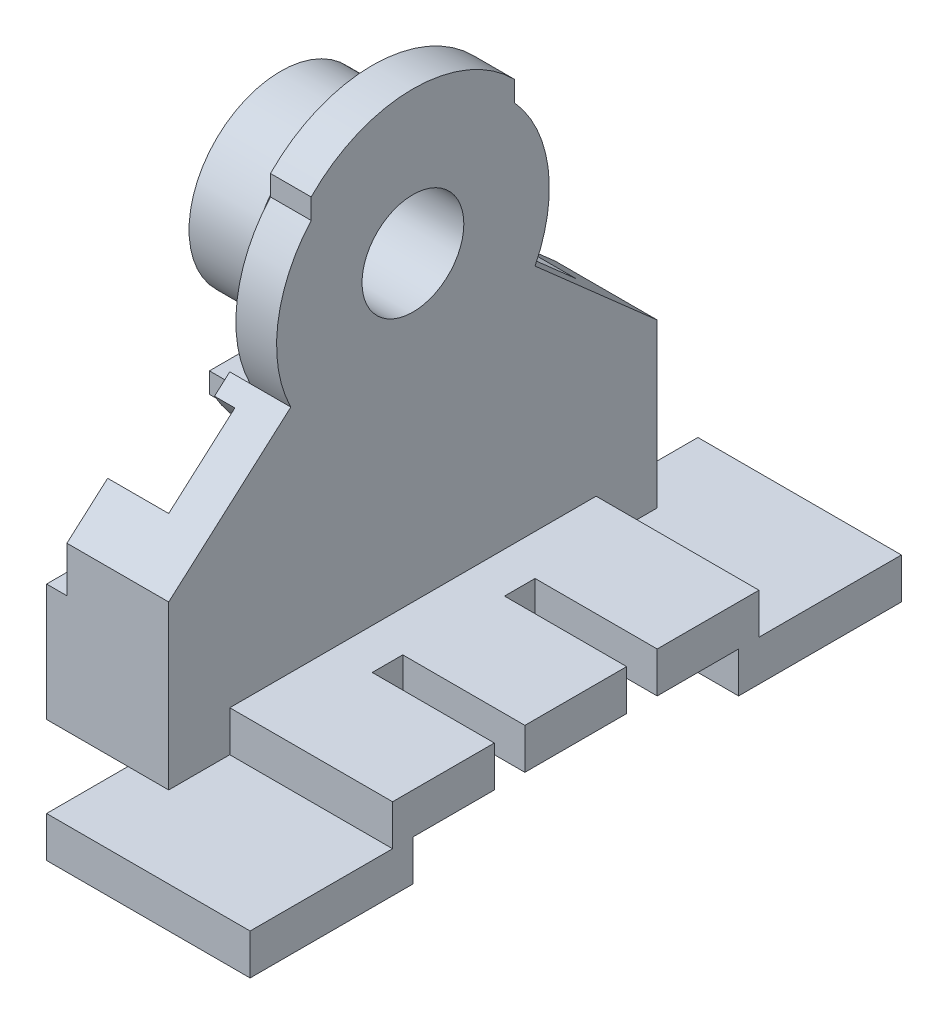
from build123d import *

# Parameters (mm, degrees)
SCHIZZO2_W                     = 10
SCHIZZO2_H                     = 8
ESTRUSIONE_ESTRUSIONE1_DEPTH   = 2
ESTRUSIONE_ESTRUSIONE1_2_DEPTH = 2
ESTRUSIONE_ESTRUSIONE2_DEPTH   = 2
ESTRUSIONE_ESTRUSIONE3_DEPTH   = 26
TAGLIO_ESTRUSIONE1_DEPTH       = 34.763886032
TAGLIO_ESTRUSIONE1_DEPTH_BACK  = 34.763886032
TAGLIO_ESTRUSIONE2_DEPTH       = 32.990517073
TAGLIO_ESTRUSIONE2_DEPTH_BACK  = 32.990517073
SCHIZZO8_R                     = 2.5
ESTRUSIONE_ESTRUSIONE4_DEPTH   = 1
SCHIZZO11_W                    = 8
SCHIZZO11_H                    = 1
ESTRUSIONE_ESTRUSIONE5_DEPTH   = 4
ESTRUSIONE_ESTRUSIONE6_START   = -4.5
SCHIZZO12_R                    = 4.5
SCHIZZO12_R_2                  = 2.5
ESTRUSIONE_ESTRUSIONE6_DEPTH   = 4.5
ESTRUSIONE_ESTRUSIONE7_START   = -1
SCHIZZO13_R                    = 5
SCHIZZO13_R_2                  = 4.5
ESTRUSIONE_ESTRUSIONE7_DEPTH   = 1
TAGLIO_ESTRUSIONE3_START       = 12
SCHIZZO14_W                    = 1
SCHIZZO14_H                    = 4
TAGLIO_ESTRUSIONE3_DEPTH       = 44.990517073
ESTRUSIONE_ESTRUSIONE8_DEPTH   = 1


with BuildPart() as part:
    # Schizzo2 → Estrusione-Estrusione1 (new body)
    with BuildSketch(Plane(origin=(0, 0, 0), x_dir=(1, 0, 0), z_dir=(0, 1, 0))):
        with Locations((5, 12)):
            Rectangle(SCHIZZO2_W, SCHIZZO2_H)
    extrude(amount=ESTRUSIONE_ESTRUSIONE1_DEPTH)



with BuildPart() as body_2:
    # Schizzo2 → Estrusione-Estrusione1 2 (new body)
    with BuildSketch(Plane(origin=(0, 0, 0), x_dir=(1, 0, 0), z_dir=(0, 1, 0))):
        with Locations((5, -12)):
            Rectangle(SCHIZZO2_W, SCHIZZO2_H)
    extrude(amount=ESTRUSIONE_ESTRUSIONE1_2_DEPTH)


with BuildPart() as part_1:
    add(part.part)

    add(body_2.part)  # Estrusione-Estrusione2 merges body 2
    # Schizzo3 → Estrusione-Estrusione2 (add)
    with BuildSketch(Plane(origin=(0, 2, 0), x_dir=(1, 0, 0), z_dir=(0, 1, 0))):
        Polygon((0, -9), (10, -9), (10, -4), (4, -4), (4, -2.5), (10, -2.5), (10, 2.5), (4, 2.5), (4, 4), (10, 4), (10, 9), (0, 9), align=None)
    extrude(amount=ESTRUSIONE_ESTRUSIONE2_DEPTH)

    # Schizzo5 → Estrusione-Estrusione3 (add)
    with BuildSketch(Plane(origin=(0, 2, 0), x_dir=(1, 0, 0), z_dir=(0, 1, 0))):
        Polygon((-4, 12), (2, 12), (2, -12), (-4, -12), (-4, -10), (0, -10), (0, 10), (-4, 10), align=None)
    extrude(amount=ESTRUSIONE_ESTRUSIONE3_DEPTH)

    # Schizzo6 → Taglio-Estrusione1 (cut, two sides: drawn at the far end of the back side and taken through both)
    with BuildSketch(Plane(origin=(0, 0, 0), x_dir=(0, 0, -1), z_dir=(1, 0, 0)).offset(-TAGLIO_ESTRUSIONE1_DEPTH_BACK)):
        with BuildLine():
            Line((-12, 10), (-12, 28))
            Line((-12, 28), (12, 28))
            Line((12, 28), (12, 10))
            Line((12, 10), (6, 15.291502622))
            ThreePointArc((6, 15.291502622), (6.640310502, 19.165456154), (5, 22.732933549))
            Line((5, 22.732933549), (5, 23.732933549))
            ThreePointArc((5, 23.732933549), (0, 25.833954064), (-5, 23.732933549))
            Line((-5, 23.732933549), (-5, 22.732933549))
            ThreePointArc((-5, 22.732933549), (-6.640310502, 19.165456154), (-6, 15.291502622))
            Line((-6, 15.291502622), (-12, 10))
        make_face()
    extrude(amount=TAGLIO_ESTRUSIONE1_DEPTH + TAGLIO_ESTRUSIONE1_DEPTH_BACK, mode=Mode.SUBTRACT)

    # Schizzo8 → Taglio-Estrusione2 (cut, two sides: drawn at the far end of the back side and taken through both)
    with BuildSketch(Plane(origin=(0, 0, 0), x_dir=(0, 0, -1), z_dir=(1, 0, 0)).offset(-TAGLIO_ESTRUSIONE2_DEPTH_BACK)):
        with Locations((0, 18.833954064)):
            Circle(SCHIZZO8_R)
    extrude(amount=TAGLIO_ESTRUSIONE2_DEPTH + TAGLIO_ESTRUSIONE2_DEPTH_BACK, mode=Mode.SUBTRACT)

    # Schizzo9 → Estrusione-Estrusione4 (add, symmetric)
    with BuildSketch(Plane.XY):
        Polygon((8, 2), (6.5, 2), (6.5, 0.5), align=None)
    extrude(amount=ESTRUSIONE_ESTRUSIONE4_DEPTH, both=True)

    # Schizzo11 → Estrusione-Estrusione5 (add)
    with BuildSketch(Plane(origin=(0, 0, 0), x_dir=(0, 0, -1), z_dir=(1, 0, 0))):
        with Locations((0, 12.333954064)):
            Rectangle(SCHIZZO11_W, SCHIZZO11_H)
    extrude(amount=-ESTRUSIONE_ESTRUSIONE5_DEPTH)

    # Schizzo12 → Estrusione-Estrusione6 (add)
    with BuildSketch(Plane(origin=(0, 0, 0), x_dir=(0, 0, -1), z_dir=(1, 0, 0)).offset(ESTRUSIONE_ESTRUSIONE6_START)):
        with Locations((0, 18.833954064)):
            Circle(SCHIZZO12_R)
        with Locations((0, 18.833954064)):
            Circle(SCHIZZO12_R_2, mode=Mode.SUBTRACT)
    extrude(amount=ESTRUSIONE_ESTRUSIONE6_DEPTH)

    # Schizzo13 → Estrusione-Estrusione7 (add)
    with BuildSketch(Plane(origin=(0, 0, 0), x_dir=(0, 0, -1), z_dir=(1, 0, 0)).offset(ESTRUSIONE_ESTRUSIONE7_START)):
        with Locations((0, 18.833954064)):
            Circle(SCHIZZO13_R)
        with Locations((0, 18.833954064)):
            Circle(SCHIZZO13_R_2, mode=Mode.SUBTRACT)
    extrude(amount=ESTRUSIONE_ESTRUSIONE7_DEPTH)

    # Schizzo14 → Taglio-Estrusione3 (cut, through all)
    with BuildSketch(Plane.XY.offset(TAGLIO_ESTRUSIONE3_START)):
        with Locations((-3.5, 9.763834207)):
            Rectangle(SCHIZZO14_W, SCHIZZO14_H)
    extrude(amount=-TAGLIO_ESTRUSIONE3_DEPTH, mode=Mode.SUBTRACT)

    # Schizzo17 → Estrusione-Estrusione8 (add)
    with BuildSketch(Plane(origin=(0, 0, 0), x_dir=(0, 0, -1), z_dir=(1, 0, 0))):
        with BuildLine():
            Line((6, 15.291502622), (6.75, 14.630064794))
            ThreePointArc((6.75, 14.630064794), (5.555843379, 13.054148343), (4, 11.833954064))
            Line((4, 11.833954064), (4, 12.833954064))
            ThreePointArc((4, 12.833954064), (5.136905867, 13.951311731), (6, 15.291502622))
        make_face()
        with BuildLine():
            Line((-6.75, 14.630064794), (-6, 15.291502622))
            ThreePointArc((-6, 15.291502622), (-5.136905867, 13.951311731), (-4, 12.833954064))
            Line((-4, 12.833954064), (-4, 11.833954064))
            ThreePointArc((-4, 11.833954064), (-5.555843379, 13.054148343), (-6.75, 14.630064794))
        make_face()
    extrude(amount=-ESTRUSIONE_ESTRUSIONE8_DEPTH)


solid = part_1.part
